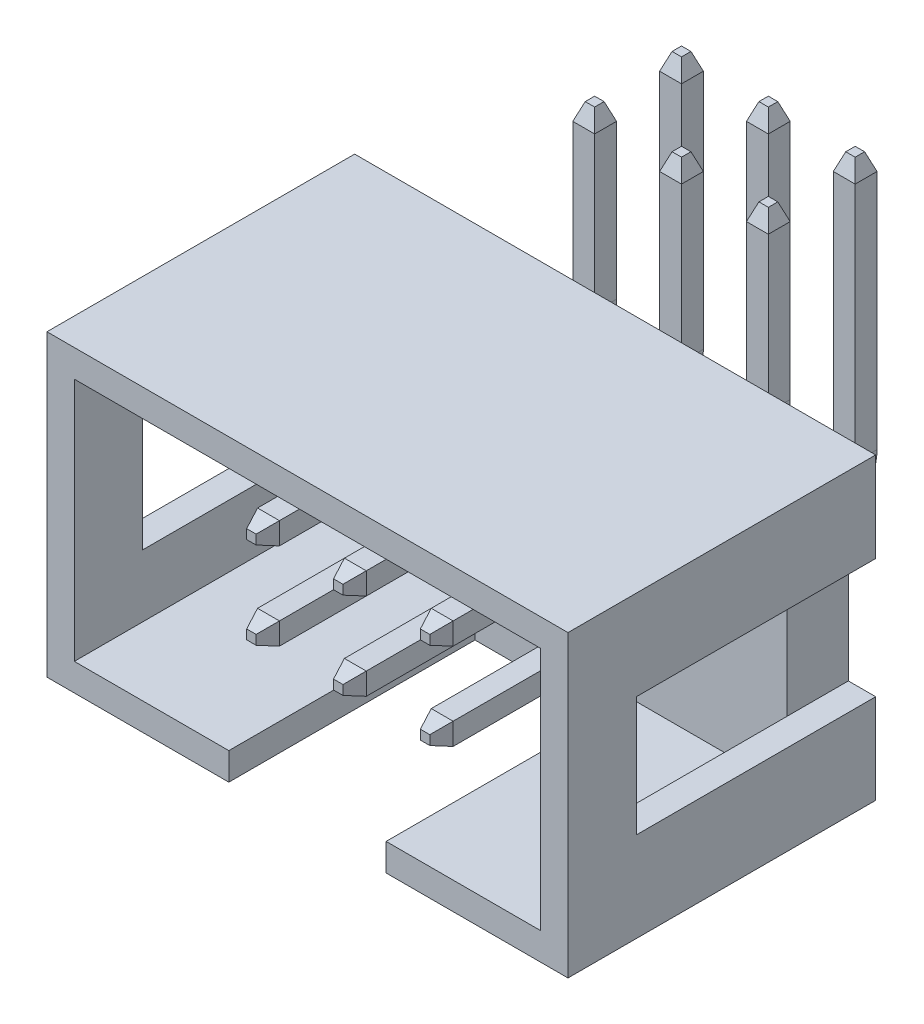
from build123d import *
from OCP.BRepFilletAPI import BRepFilletAPI_MakeChamfer

# Parameters (mm, degrees)
SKETCH_1_W             = 15.24
SKETCH_1_H             = 8.75
EXTRUDE_1_DEPTH        = 1.8
SKETCH_2_W             = 15.24
SKETCH_2_H             = 8.75
SKETCH_2_W_2           = 13.64
SKETCH_2_H_2           = 7.15
EXTRUDE_2_DEPTH        = 7.2
CUT_EXTRUDE_START      = -1.8
SKETCH_3_W             = 0.8
SKETCH_3_H             = 3.5
CUT_EXTRUDE_1_DEPTH    = 7
SKETCH_4_W             = 4.6
SKETCH_4_H             = 0.8
CUT_EXTRUDE_2_DEPTH    = 7.2
CUT_EXTRUDE_3_DEPTH    = 0.1
SKETCH_8_W             = 0.64
SKETCH_8_H             = 0.64
SKETCH_5_W             = 0.64
SKETCH_5_H             = 0.64
CHAMFER_16_SIZE        = 0.5
CHAMFER_16_SIZE2       = 0.181985117
CHAMFER_17_SIZE        = 0.5
CHAMFER_17_SIZE2       = 0.181985117
CHAMFER_18_SIZE        = 0.5
CHAMFER_18_SIZE2       = 0.181985117
CHAMFER_19_SIZE        = 0.5
CHAMFER_19_SIZE2       = 0.181985117
PATTERN_LINEAR_2_COUNT = 2
PATTERN_LINEAR_2_PITCH = 2.54
PATTERN_LINEAR_3_COUNT = 2
PATTERN_LINEAR_3_PITCH = 2.54


with BuildPart() as part:
    # Эскиз1 → Бобышка-Вытянуть1 (new body)
    with BuildSketch(Plane.XY):
        Rectangle(SKETCH_1_W, SKETCH_1_H)
    extrude(amount=EXTRUDE_1_DEPTH)

    # Эскиз2 → Бобышка-Вытянуть2 (add)
    with BuildSketch(Plane.XY.offset(1.8)):
        Rectangle(SKETCH_2_W, SKETCH_2_H)
        Rectangle(SKETCH_2_W_2, SKETCH_2_H_2, mode=Mode.SUBTRACT)
    extrude(amount=EXTRUDE_2_DEPTH)

    # Эскиз3 → Вырез-Вытянуть1 (cut)
    with BuildSketch(Plane.XY.offset(1.8).offset(CUT_EXTRUDE_START)):
        with Locations((7.22, 0)):
            Rectangle(SKETCH_3_W, SKETCH_3_H)
        with Locations((-7.22, 0)):
            Rectangle(SKETCH_3_W, SKETCH_3_H)
    extrude(amount=CUT_EXTRUDE_1_DEPTH, mode=Mode.SUBTRACT)

    # Эскиз4 → Вырез-Вытянуть2 (cut)
    with BuildSketch(Plane.XY.offset(9)):
        with Locations((0, -3.975)):
            Rectangle(SKETCH_4_W, SKETCH_4_H)
    extrude(amount=-CUT_EXTRUDE_2_DEPTH, mode=Mode.SUBTRACT)

    # Эскиз6 → Вырез-Вытянуть3 (cut)
    with BuildSketch(Plane.XZ.offset(4.375)):
        Polygon((-4.976440372, 5.189720174), (-3.184624847, 5.189720174), (-4.08053261, 3.716247509), align=None)
    extrude(amount=-CUT_EXTRUDE_3_DEPTH, mode=Mode.SUBTRACT)


with BuildPart() as body_2:
    # По траектории2: sweep along a path in Эскиз9
    with BuildLine(Plane.ZY) as sweep_2_path:
        Line((8.1, -1.27), (0, -1.27))
        Line((0, -1.27), (-3.48, -1.27))
        ThreePointArc((-3.48, -1.27), (-4.187106781, -0.977106781), (-4.48, -0.27))
        Line((-4.48, -0.27), (-4.48, 7.275))
    # Эскиз8 → По траектории2 (sweep)
    with BuildSketch(Plane.XY):
        with Locations((0, -1.27)):
            Rectangle(SKETCH_8_W, SKETCH_8_H)
    sweep(path=sweep_2_path.line)

    # Фаска17: one chamfer whose edges measure the first distance from different faces: ONE call of the kernel's chamfer builder (chamfer() names one face for all edges)
    chamfer_17_edges_1 = [body_2.edges().sort_by_distance(p)[0] for p in [
        (0, 7.275, -4.16),
    ]]
    chamfer_17_side_1 = [body_2.faces().sort_by_distance(p)[0] for p in [
        (0, 3.5025, -4.16),
    ]]
    chamfer_17_edges_2 = [body_2.edges().sort_by_distance(p)[0] for p in [
        (-0.32, 7.275, -4.48),
    ]]
    chamfer_17_side_2 = [body_2.faces().sort_by_distance(p)[0] for p in [
        (-0.32, -1.27, 7.943475809),
    ]]
    chamfer_17_edges_3 = [body_2.edges().sort_by_distance(p)[0] for p in [
        (0, 7.275, -4.8),
    ]]
    chamfer_17_side_3 = [body_2.faces().sort_by_distance(p)[0] for p in [
        (0, 3.5025, -4.8),
    ]]
    chamfer_17_edges_4 = [body_2.edges().sort_by_distance(p)[0] for p in [
        (0.32, 7.275, -4.48),
    ]]
    chamfer_17_side_4 = [body_2.faces().sort_by_distance(p)[0] for p in [
        (0.32, -1.27, 7.943475809),
    ]]
    chamfer_17 = BRepFilletAPI_MakeChamfer(body_2.part.solid().wrapped)
    for e in chamfer_17_edges_1:
        chamfer_17.Add(CHAMFER_17_SIZE, CHAMFER_17_SIZE2, e.wrapped, chamfer_17_side_1[0].wrapped)  # the first distance lies on this face
    for e in chamfer_17_edges_2:
        chamfer_17.Add(CHAMFER_17_SIZE, CHAMFER_17_SIZE2, e.wrapped, chamfer_17_side_2[0].wrapped)  # the first distance lies on this face
    for e in chamfer_17_edges_3:
        chamfer_17.Add(CHAMFER_17_SIZE, CHAMFER_17_SIZE2, e.wrapped, chamfer_17_side_3[0].wrapped)  # the first distance lies on this face
    for e in chamfer_17_edges_4:
        chamfer_17.Add(CHAMFER_17_SIZE, CHAMFER_17_SIZE2, e.wrapped, chamfer_17_side_4[0].wrapped)  # the first distance lies on this face
    add(Compound.cast(chamfer_17.Shape()), mode=Mode.REPLACE)

    # Фаска18: one chamfer whose edges measure the first distance from different faces: ONE call of the kernel's chamfer builder (chamfer() names one face for all edges)
    chamfer_18_edges_1 = [body_2.edges().sort_by_distance(p)[0] for p in [
        (0.32, -1.27, 8.1),
    ]]
    chamfer_18_side_1 = [body_2.faces().sort_by_distance(p)[0] for p in [
        (0.32, 3.2525, -4.313747593),
    ]]
    chamfer_18_edges_2 = [body_2.edges().sort_by_distance(p)[0] for p in [
        (0, -0.95, 8.1),
    ]]
    chamfer_18_side_2 = [body_2.faces().sort_by_distance(p)[0] for p in [
        (0, -0.95, 2.31),
    ]]
    chamfer_18_edges_3 = [body_2.edges().sort_by_distance(p)[0] for p in [
        (-0.32, -1.27, 8.1),
    ]]
    chamfer_18_side_3 = [body_2.faces().sort_by_distance(p)[0] for p in [
        (-0.32, 3.2525, -4.646252407),
    ]]
    chamfer_18_edges_4 = [body_2.edges().sort_by_distance(p)[0] for p in [
        (0, -1.59, 8.1),
    ]]
    chamfer_18_side_4 = [body_2.faces().sort_by_distance(p)[0] for p in [
        (0, -1.59, 2.31),
    ]]
    chamfer_18 = BRepFilletAPI_MakeChamfer(body_2.part.solid().wrapped)
    for e in chamfer_18_edges_1:
        chamfer_18.Add(CHAMFER_18_SIZE, CHAMFER_18_SIZE2, e.wrapped, chamfer_18_side_1[0].wrapped)  # the first distance lies on this face
    for e in chamfer_18_edges_2:
        chamfer_18.Add(CHAMFER_18_SIZE, CHAMFER_18_SIZE2, e.wrapped, chamfer_18_side_2[0].wrapped)  # the first distance lies on this face
    for e in chamfer_18_edges_3:
        chamfer_18.Add(CHAMFER_18_SIZE, CHAMFER_18_SIZE2, e.wrapped, chamfer_18_side_3[0].wrapped)  # the first distance lies on this face
    for e in chamfer_18_edges_4:
        chamfer_18.Add(CHAMFER_18_SIZE, CHAMFER_18_SIZE2, e.wrapped, chamfer_18_side_4[0].wrapped)  # the first distance lies on this face
    add(Compound.cast(chamfer_18.Shape()), mode=Mode.REPLACE)


with BuildPart() as body_3:
    # По траектории3: sweep along a path in Эскиз7
    with BuildLine(Plane(origin=(0, 0, 0), x_dir=(0, 0, -1), z_dir=(1, 0, 0))) as sweep_3_path:
        Line((-8.1, 1.27), (-1.8, 1.27))
        Line((-1.8, 1.27), (0.94, 1.27))
        ThreePointArc((0.94, 1.27), (1.647106781, 1.562893219), (1.94, 2.27))
        Line((1.94, 2.27), (1.94, 7.275))
    # Эскиз5 → По траектории3 (sweep)
    with BuildSketch(Plane.XY.offset(1.8)):
        with Locations((0, 1.27)):
            Rectangle(SKETCH_5_W, SKETCH_5_H)
    sweep(path=sweep_3_path.line)

    # Фаска16: one chamfer whose edges measure the first distance from different faces: ONE call of the kernel's chamfer builder (chamfer() names one face for all edges)
    chamfer_16_edges_1 = [body_3.edges().sort_by_distance(p)[0] for p in [
        (0, 7.275, -1.62),
    ]]
    chamfer_16_side_1 = [body_3.faces().sort_by_distance(p)[0] for p in [
        (0, 4.7725, -1.62),
    ]]
    chamfer_16_edges_2 = [body_3.edges().sort_by_distance(p)[0] for p in [
        (-0.32, 7.275, -1.94),
    ]]
    chamfer_16_side_2 = [body_3.faces().sort_by_distance(p)[0] for p in [
        (-0.32, 1.27, 7.978618278),
    ]]
    chamfer_16_edges_3 = [body_3.edges().sort_by_distance(p)[0] for p in [
        (0, 7.275, -2.26),
    ]]
    chamfer_16_side_3 = [body_3.faces().sort_by_distance(p)[0] for p in [
        (0, 4.7725, -2.26),
    ]]
    chamfer_16_edges_4 = [body_3.edges().sort_by_distance(p)[0] for p in [
        (0.32, 7.275, -1.94),
    ]]
    chamfer_16_side_4 = [body_3.faces().sort_by_distance(p)[0] for p in [
        (0.32, 1.27, 7.978618278),
    ]]
    chamfer_16 = BRepFilletAPI_MakeChamfer(body_3.part.solid().wrapped)
    for e in chamfer_16_edges_1:
        chamfer_16.Add(CHAMFER_16_SIZE, CHAMFER_16_SIZE2, e.wrapped, chamfer_16_side_1[0].wrapped)  # the first distance lies on this face
    for e in chamfer_16_edges_2:
        chamfer_16.Add(CHAMFER_16_SIZE, CHAMFER_16_SIZE2, e.wrapped, chamfer_16_side_2[0].wrapped)  # the first distance lies on this face
    for e in chamfer_16_edges_3:
        chamfer_16.Add(CHAMFER_16_SIZE, CHAMFER_16_SIZE2, e.wrapped, chamfer_16_side_3[0].wrapped)  # the first distance lies on this face
    for e in chamfer_16_edges_4:
        chamfer_16.Add(CHAMFER_16_SIZE, CHAMFER_16_SIZE2, e.wrapped, chamfer_16_side_4[0].wrapped)  # the first distance lies on this face
    add(Compound.cast(chamfer_16.Shape()), mode=Mode.REPLACE)

    # Фаска19: one chamfer whose edges measure the first distance from different faces: ONE call of the kernel's chamfer builder (chamfer() names one face for all edges)
    chamfer_19_edges_1 = [body_3.edges().sort_by_distance(p)[0] for p in [
        (0.32, 1.27, 8.1),
    ]]
    chamfer_19_side_1 = [body_3.faces().sort_by_distance(p)[0] for p in [
        (0.32, 4.5225, -1.738852945),
    ]]
    chamfer_19_edges_2 = [body_3.edges().sort_by_distance(p)[0] for p in [
        (0, 1.59, 8.1),
    ]]
    chamfer_19_side_2 = [body_3.faces().sort_by_distance(p)[0] for p in [
        (0, 1.59, 3.58),
    ]]
    chamfer_19_edges_3 = [body_3.edges().sort_by_distance(p)[0] for p in [
        (-0.32, 1.27, 8.1),
    ]]
    chamfer_19_side_3 = [body_3.faces().sort_by_distance(p)[0] for p in [
        (-0.32, 4.5225, -2.141147055),
    ]]
    chamfer_19_edges_4 = [body_3.edges().sort_by_distance(p)[0] for p in [
        (0, 0.95, 8.1),
    ]]
    chamfer_19_side_4 = [body_3.faces().sort_by_distance(p)[0] for p in [
        (0, 0.95, 3.58),
    ]]
    chamfer_19 = BRepFilletAPI_MakeChamfer(body_3.part.solid().wrapped)
    for e in chamfer_19_edges_1:
        chamfer_19.Add(CHAMFER_19_SIZE, CHAMFER_19_SIZE2, e.wrapped, chamfer_19_side_1[0].wrapped)  # the first distance lies on this face
    for e in chamfer_19_edges_2:
        chamfer_19.Add(CHAMFER_19_SIZE, CHAMFER_19_SIZE2, e.wrapped, chamfer_19_side_2[0].wrapped)  # the first distance lies on this face
    for e in chamfer_19_edges_3:
        chamfer_19.Add(CHAMFER_19_SIZE, CHAMFER_19_SIZE2, e.wrapped, chamfer_19_side_3[0].wrapped)  # the first distance lies on this face
    for e in chamfer_19_edges_4:
        chamfer_19.Add(CHAMFER_19_SIZE, CHAMFER_19_SIZE2, e.wrapped, chamfer_19_side_4[0].wrapped)  # the first distance lies on this face
    add(Compound.cast(chamfer_19.Shape()), mode=Mode.REPLACE)


with BuildPart() as pattern_linear_2_1:
    # Линейный массив2: pattern copy
    add(body_2.part.moved(Location(Vector(1, 0, 0) * (1 * PATTERN_LINEAR_2_PITCH))))


with BuildPart() as pattern_linear_2_2:
    # Линейный массив2: pattern copy
    add(body_3.part.moved(Location(Vector(1, 0, 0) * (1 * PATTERN_LINEAR_2_PITCH))))


with BuildPart() as pattern_linear_3_1:
    # Линейный массив3: pattern copy
    add(body_2.part.moved(Location(Vector(-1, 0, 0) * (1 * PATTERN_LINEAR_3_PITCH))))


with BuildPart() as pattern_linear_3_2:
    # Линейный массив3: pattern copy
    add(body_3.part.moved(Location(Vector(-1, 0, 0) * (1 * PATTERN_LINEAR_3_PITCH))))


solid = Compound([part.part, body_2.part, body_3.part, pattern_linear_2_1.part, pattern_linear_2_2.part, pattern_linear_3_1.part, pattern_linear_3_2.part])
